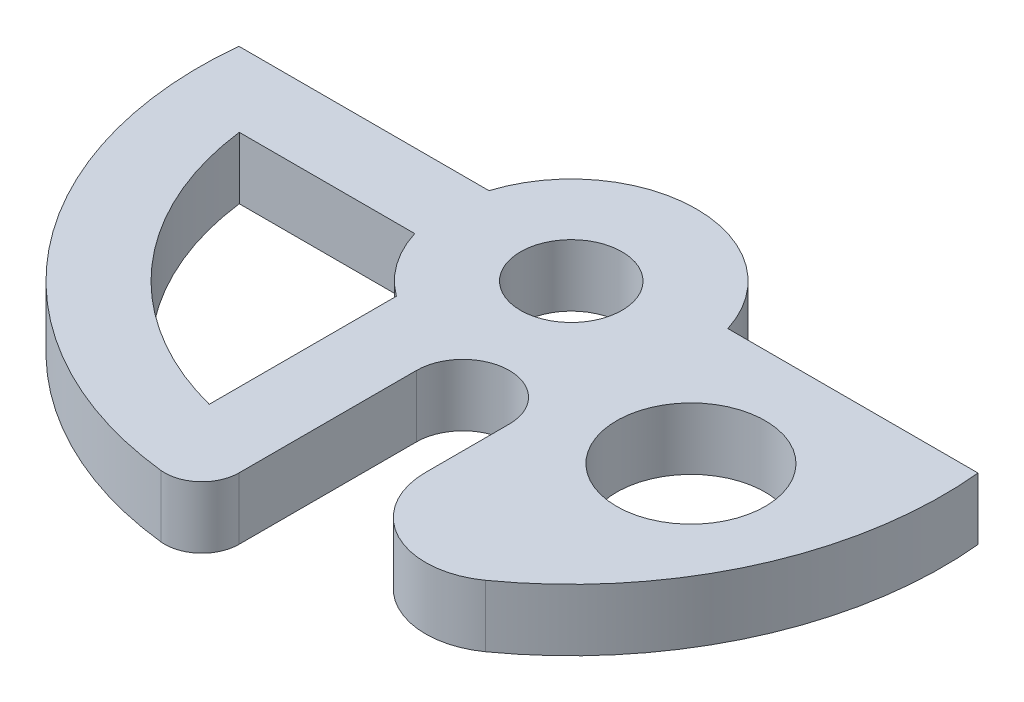
from build123d import *

# Parameters (mm, degrees)
SKETCH1_R           = 4.1
SKETCH1_R_2         = 6.3
BOSS_EXTRUDE1_DEPTH = 5
FILLET1_R           = 3
CUT_EXTRUDE1_DEPTH  = 43.720018727
SKETCH3_R           = 6
CUT_EXTRUDE2_DEPTH  = 43.60278036


with BuildPart() as part:
    # Sketch1 → Boss-Extrude1 (new body)
    # profile 1 of 2: a face of its own
    with BuildSketch(Plane(origin=(0, 0, 0), x_dir=(1, 0, 0), z_dir=(0, 1, 0))):
        with BuildLine():
            Line((0, -30), (0, -12.5))
            ThreePointArc((0, -12.5), (3.75, -8.75), (7.5, -12.5))
            Line((7.5, -12.5), (7.5, -19.267848855))
            ThreePointArc((7.5, -19.267848855), (13.800000007, -12.967848868), (20.1, -19.267848868))
            ThreePointArc((20.1, -19.267848868), (19.403598453, -22.147030066), (17.468354167, -24.3896823))
            ThreePointArc((17.468354167, -24.3896823), (26.683802437, -13.710386117), (30, 0))
            ThreePointArc((30, 0), (-21.213203436, 21.213203436), (0, -30))
        make_face()
        with Locations(Location((0, 0, 0), (0, 0, 270))):
            Circle(SKETCH1_R, mode=Mode.SUBTRACT)
    # profile 2 of 2: a face of its own
    with BuildSketch(Plane(origin=(0, 0, 0), x_dir=(1, 0, 0), z_dir=(0, 1, 0))):
        with Locations((13.8, -19.267848868)):
            Circle(SKETCH1_R_2)
    extrude(amount=BOSS_EXTRUDE1_DEPTH)

    # Fillet1
    fillet1_edges = [part.edges().sort_by_distance(p)[0] for p in [
        (0, 2.5, 30),
    ]]
    fillet(fillet1_edges, radius=FILLET1_R)

    # Sketch2 → Cut-Extrude1 (cut, through all)
    with BuildSketch(Plane(origin=(0, 5, 0), x_dir=(1, 0, 0), z_dir=(0, 1, 0))):
        with BuildLine():
            Line((-24, 3), (-23.8117618, 3))
            ThreePointArc((-23.8117618, 3), (0, 24), (23.8117618, 3))
            Line((23.8117618, 3), (24, 3))
            Line((24, 3), (29.849623113, 3))
            ThreePointArc((29.849623113, 3), (0, 30), (-29.849623113, 3))
            Line((-29.849623113, 3), (-24, 3))
        make_face()
        with BuildLine():
            ThreePointArc((23.8117618, 3), (0, 24), (-23.8117618, 3))
            Line((-23.8117618, 3), (-9.644169223, 3))
            ThreePointArc((-9.644169223, 3), (0, 10.1), (9.644169223, 3))
            Line((9.644169223, 3), (23.8117618, 3))
        make_face()
        with BuildLine():
            ThreePointArc((-23.8117618, -3), (-18.016060482, -15.856278401), (-6, -23.237900077))
            Line((-6, -23.237900077), (-6, -8.124653839))
            ThreePointArc((-6, -8.124653839), (-8.231070824, -5.85315924), (-9.644169223, -3))
            Line((-9.644169223, -3), (-23.8117618, -3))
        make_face()
    extrude(amount=-CUT_EXTRUDE1_DEPTH, mode=Mode.SUBTRACT)

    # Sketch3 → Cut-Extrude2 (cut, through all)
    with BuildSketch(Plane(origin=(0, 5, 0), x_dir=(1, 0, 0), z_dir=(0, 1, 0))):
        with Locations(Location((17.596672685, -7.929343091, 0), (0, 0, 270))):
            Circle(SKETCH3_R)
    extrude(amount=-CUT_EXTRUDE2_DEPTH, mode=Mode.SUBTRACT)


solid = part.part
